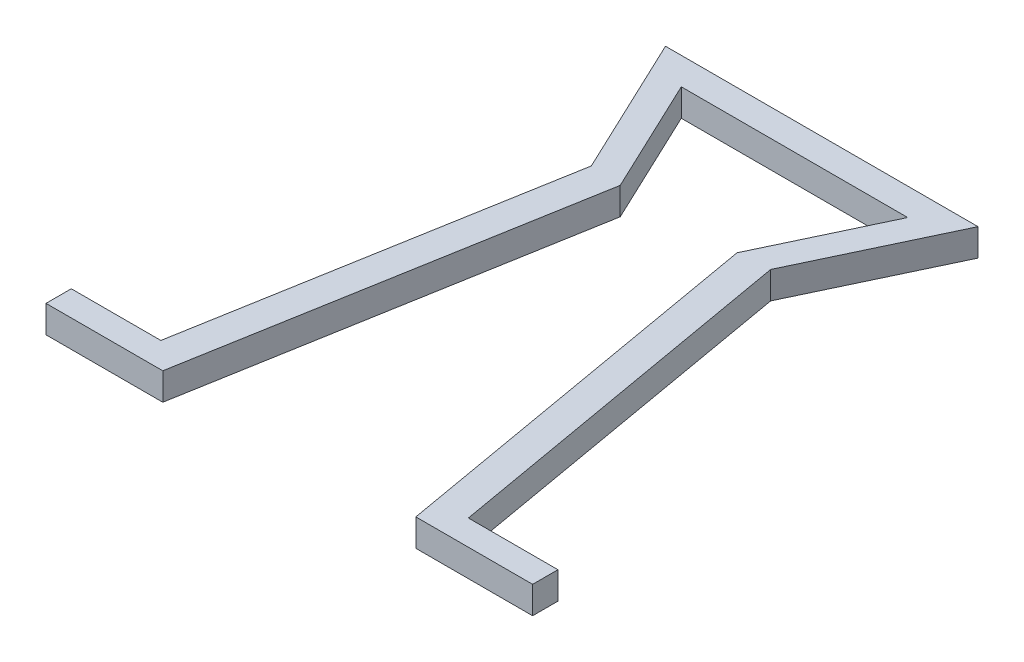
from build123d import *

# Parameters (mm, degrees)
BOSS_EXTRUDE1_DEPTH = 1.778


with BuildPart() as part:
    # Sketch1 → Boss-Extrude1 (new body)
    with BuildSketch(Plane(origin=(0, 0, 0), x_dir=(1, 0, 0), z_dir=(0, 1, 0))):
        Polygon((-15.24, 0), (-7.62, 0), (-3.175, 25.4), (-6.751512317, 32.960588734), (8.021512317, 32.960588734), (4.445, 25.4), (8.89, 0), (16.51, 0), (16.51, 1.651), (10.668, 1.651), (6.484913976, 25.554348707), (10.829489344, 34.738588734), (-9.559489344, 34.738588734), (-5.214913976, 25.554348707), (-9.398, 1.651), (-15.24, 1.651), align=None)
    extrude(amount=BOSS_EXTRUDE1_DEPTH)


solid = part.part
